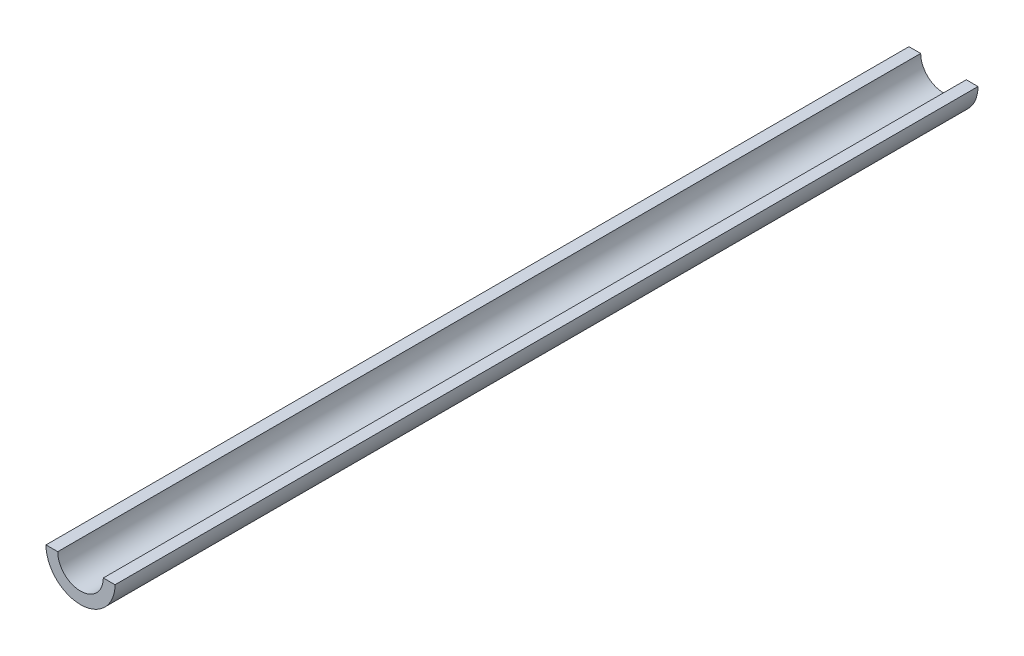
from build123d import *

# Parameters (mm, degrees)
EXTRUDE_1_DEPTH = 250


with BuildPart() as part:
    # 草图1 → 凸台-拉伸1 (new body)
    with BuildSketch(Plane.XY):
        with BuildLine():
            Line((-10, 0), (-6.6, 0))
            ThreePointArc((-6.6, 0), (0, -6.6), (6.6, 0))
            Line((6.6, 0), (10, 0))
            ThreePointArc((10, 0), (0, -10), (-10, 0))
        make_face()
    extrude(amount=EXTRUDE_1_DEPTH)


solid = part.part
